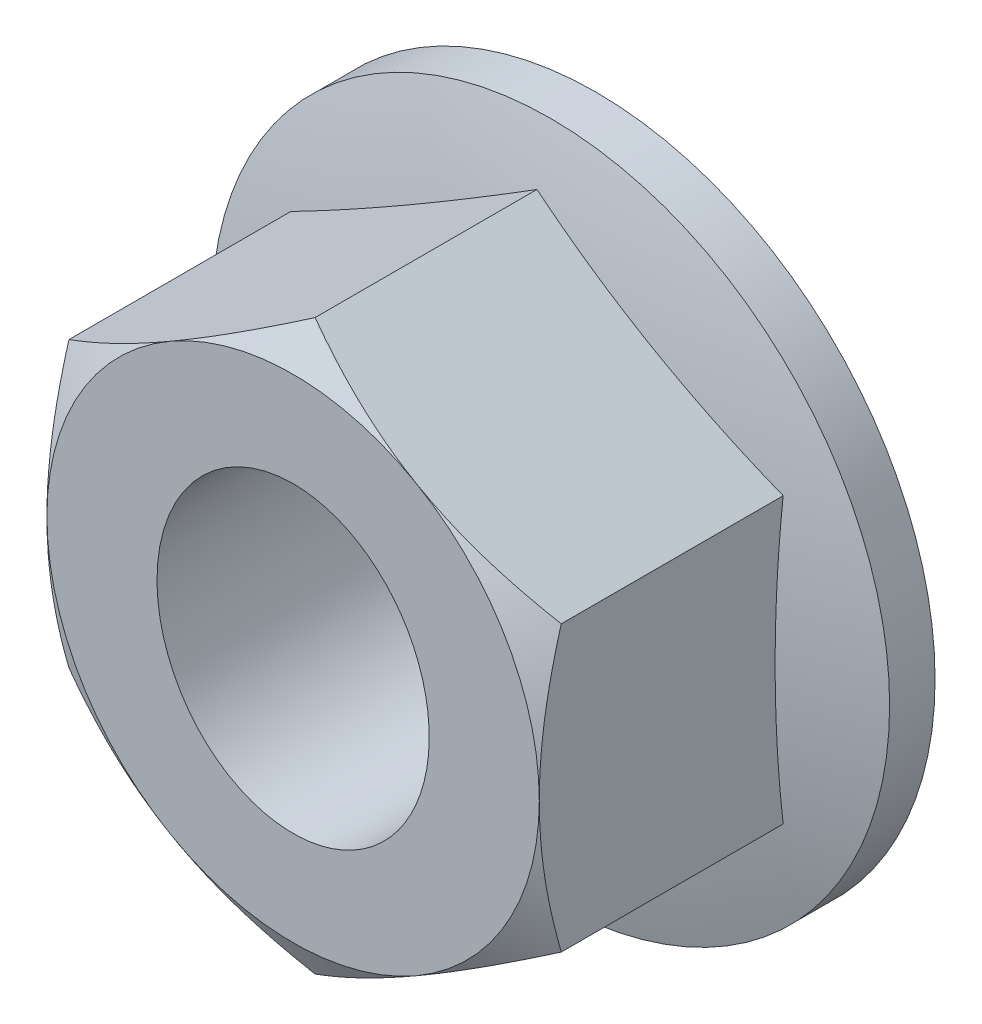
from build123d import *

# Parameters (mm, degrees)
EXTRUDE1_DEPTH      = 4
SKETCH2_OUTSIDE_W   = 80.544
SKETCH2_OUTSIDE_H   = 80.544
SKETCH2_OUTSIDE_R   = 6.5
CUT_EXTRUDE1_DEPTH  = 15.97347655
CUT_EXTRUDE1_DRAFT  = -60
SKETCH5_R           = 4
CUT_EXTRUDE10_DEPTH = 15.97347655
SKETCH16_R          = 6.5
SKETCH16_RX         = 4
SKETCH16_RY         = 3.594050592
EXTRUDE2_DEPTH      = 8


with BuildPart() as part:
    # Sketch1 → Extrude1 (new, symmetric)
    with BuildSketch(Plane.XY):
        Polygon((6.5, -3.75277675), (6.5, 3.75277675), (0, 7.505553499), (-6.5, 3.75277675), (-6.5, -3.75277675), (0, -7.505553499), align=None)
    extrude(amount=EXTRUDE1_DEPTH, both=True)

    # Sketch18 → Revolve1 (revolve)
    with BuildSketch(Plane(origin=(0, 0, 0), x_dir=(0, 0, -1), z_dir=(1, 0, 0))):
        with BuildLine():
            Line((4, 0), (4, 8.95))
            Line((4, 8.95), (2.8, 8.95))
            ThreePointArc((2.8, 8.95), (1.901336288, 4.515044297), (1.6, 0))
            Line((1.6, 0), (4, 0))
        make_face()
    revolve(axis=Axis((0, 0, -4), (0, 0, 1)))


with BuildPart() as cut_extrude1_tool:
    # Sketch2 outside → Cut-Extrude1 (with draft: the straight prism first)
    with BuildSketch(Plane.XY.offset(4)):
        Rectangle(SKETCH2_OUTSIDE_W, SKETCH2_OUTSIDE_H)
        Circle(SKETCH2_OUTSIDE_R, mode=Mode.SUBTRACT)
    extrude(amount=-CUT_EXTRUDE1_DEPTH)
    # Cut-Extrude1: the draft: its side faces are tilted about the plane it starts from
    cut_extrude1_sides = [cut_extrude1_tool.faces().sort_by_distance(p)[0] for p in [
        (0, -40.272, -3.986738275),
        (40.272, 0, -3.986738275),
        (0, 40.272, -3.986738275),
        (-40.272, 0, -3.986738275),
        (-6.5, 0, -3.986738275),
    ]]
    draft(cut_extrude1_sides, Plane.XY.offset(4), CUT_EXTRUDE1_DRAFT)


with BuildPart() as part_1:
    add(part.part)

    # Cut-Extrude1: cut by cut_extrude1_tool
    add(cut_extrude1_tool.part, mode=Mode.SUBTRACT)

    # Sketch5 → Cut-Extrude10 (cut, through all)
    with BuildSketch(Plane(origin=(0, 0, 4), x_dir=(-1, 0, 0), z_dir=(0, 0, -1))):
        Circle(SKETCH5_R)
    extrude(amount=CUT_EXTRUDE10_DEPTH, mode=Mode.SUBTRACT)

    # Sketch16 → Extrude2 (add)
    with BuildSketch(Plane.XY.offset(4)):
        Circle(SKETCH16_R)
        with Locations(Location((0, 0), (0, 0, 90))):
            Ellipse(SKETCH16_RX, SKETCH16_RY, mode=Mode.SUBTRACT)
    extrude(amount=-EXTRUDE2_DEPTH)


solid = part_1.part
